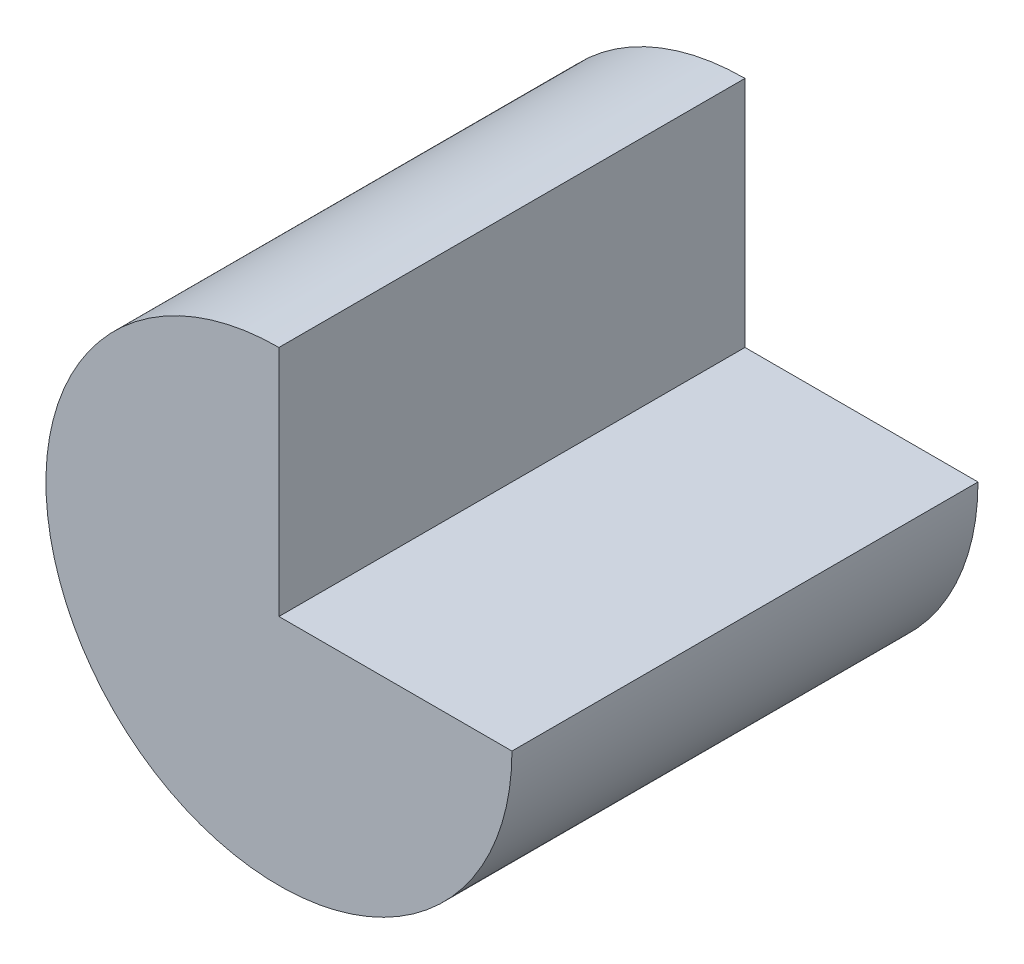
from build123d import *

# Parameters (mm, degrees)
BOSS_EXTRUDE1_DEPTH = 152.4


with BuildPart() as part:
    # Sketch1 → Boss-Extrude1 (new body)
    with BuildSketch(Plane.XY):
        with BuildLine():
            Line((0, 76.2), (0, 0))
            Line((0, 0), (76.2, 0))
            ThreePointArc((76.2, 0), (-53.881536726, -53.881536726), (0, 76.2))
        make_face()
    extrude(amount=-BOSS_EXTRUDE1_DEPTH)


solid = part.part
